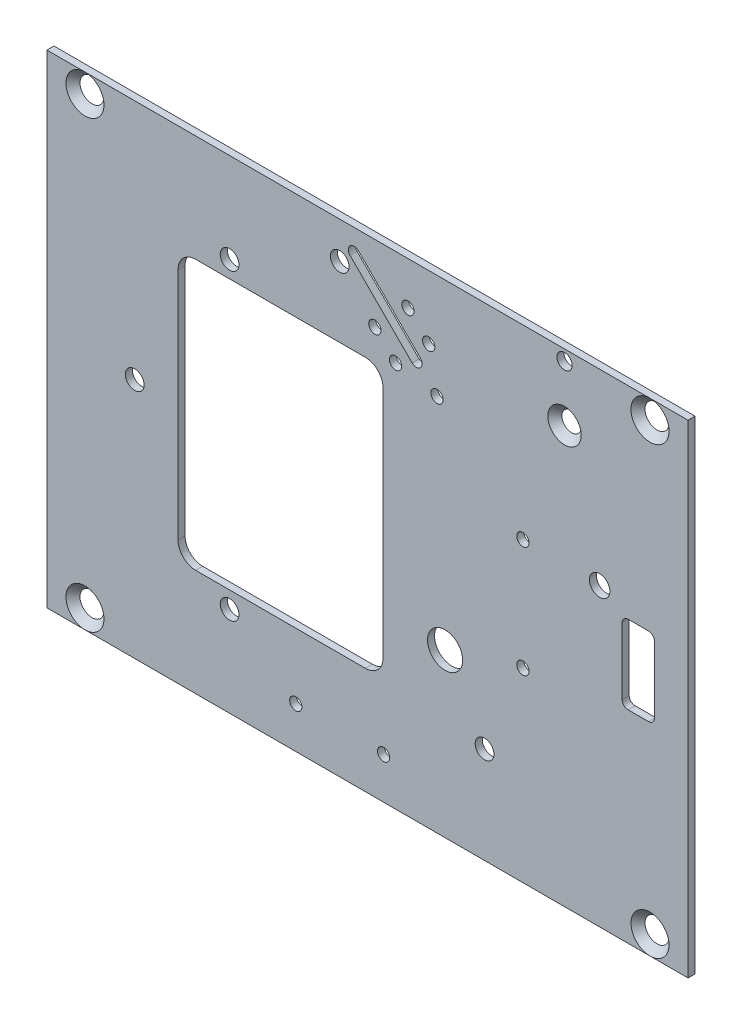
from build123d import *

# Parameters (mm, degrees)
SKETCH1_W                                    = 109.5
SKETCH1_H                                    = 82.5
SKETCH1_R                                    = 1.6
SKETCH1_R_2                                  = 1.05
SKETCH1_R_3                                  = 1.75
BOSS_EXTRUDE1_DEPTH                          = 1.2
CSK_FOR_M3_FLAT_COUNTERSUNK_HEAD_SCR_2_COUNT = 2
CSK_FOR_M3_FLAT_COUNTERSUNK_HEAD_SCR_2_PITCH = 76
CSK_FOR_M3_FLAT_COUNTERSUNK_HEAD_SCR_3_COUNT = 2
CSK_FOR_M3_FLAT_COUNTERSUNK_HEAD_SCR_3_PITCH = 122.834237898
CSK_FOR_M3_FLAT_COUNTERSUNK_HEAD_SCR_4_COUNT = 2
CSK_FOR_M3_FLAT_COUNTERSUNK_HEAD_SCR_4_PITCH = 96.5
F_2_6_2_6_DIAMETER_HOLE1_D                   = 2.6
CUT_EXTRUDE1_REACH                           = 101.438
SKETCH9_R                                    = 1.05
SKETCH9_R_2                                  = 3
SKETCH9_W                                    = 35
SKETCH9_H                                    = 46
SKETCH9_W_2                                  = 5.5
SKETCH9_H_2                                  = 13.4
FILLET1_R                                    = 3
FILLET2_R                                    = 1
SKETCH10_W                                   = 6
SKETCH10_H                                   = 6
BOSS_EXTRUDE2_DEPTH                          = 10


with BuildPart() as part:
    # Sketch1 → Boss-Extrude1 (new body)
    with BuildSketch(Plane.XY):
        with Locations((0, -41.75)):
            Rectangle(SKETCH1_W, SKETCH1_H)
        with Locations((-23.55, -67.625)):
            Circle(SKETCH1_R, mode=Mode.SUBTRACT)
        with Locations((-23.55, -15.875)):
            Circle(SKETCH1_R, mode=Mode.SUBTRACT)
        with Locations((-4.75, -6.75)):
            Circle(SKETCH1_R, mode=Mode.SUBTRACT)
        with Locations((-39.75, -41.75)):
            Circle(SKETCH1_R, mode=Mode.SUBTRACT)
        with Locations((19.998737342, -66.498737342)):
            Circle(SKETCH1_R, mode=Mode.SUBTRACT)
        with Locations((-12.25, -75.92862289)):
            Circle(SKETCH1_R_2, mode=Mode.SUBTRACT)
        with Locations((2.75, -75.92862289)):
            Circle(SKETCH1_R_2, mode=Mode.SUBTRACT)
        with Locations((26.542856399, -51.25)):
            Circle(SKETCH1_R_2, mode=Mode.SUBTRACT)
        with Locations((26.542856399, -32.25)):
            Circle(SKETCH1_R_2, mode=Mode.SUBTRACT)
        with Locations((39.65, -32.5)):
            Circle(SKETCH1_R_3, mode=Mode.SUBTRACT)
    extrude(amount=BOSS_EXTRUDE1_DEPTH)

    # Sketch3 → CSK for M3 Flat Countersunk Head Screw1 (revolve, cut)
    with BuildSketch(Plane(origin=(-48.25, -3.75, 1.2), x_dir=(0, -1, 0), z_dir=(1, 0, 0))):
        Polygon((0, 0), (0, 1.2), (1.6, 1.2), (1.6, 1.65), (3.25, 0), align=None)
    csk_for_m3_flat_countersunk_head_screw1 = revolve(axis=Axis((-48.25, -3.75, 7.55), (0, 0, -1)), mode=Mode.SUBTRACT)

    # CSK for M3 Flat Countersunk Head Scr 2: CSK for M3 Flat Countersunk Head Screw1 ×2
    with Locations(*[(0, -i * CSK_FOR_M3_FLAT_COUNTERSUNK_HEAD_SCR_2_PITCH, 0) for i in range(1, CSK_FOR_M3_FLAT_COUNTERSUNK_HEAD_SCR_2_COUNT)]):
        add(csk_for_m3_flat_countersunk_head_screw1, mode=Mode.SUBTRACT)

    # CSK for M3 Flat Countersunk Head Scr 3: CSK for M3 Flat Countersunk Head Screw1 ×2
    with Locations(*[Vector(0.7856115823348563, -0.6187200026678655, 0) * (i * CSK_FOR_M3_FLAT_COUNTERSUNK_HEAD_SCR_3_PITCH) for i in range(1, CSK_FOR_M3_FLAT_COUNTERSUNK_HEAD_SCR_3_COUNT)]):
        add(csk_for_m3_flat_countersunk_head_screw1, mode=Mode.SUBTRACT)

    # CSK for M3 Flat Countersunk Head Scr 4: CSK for M3 Flat Countersunk Head Screw1 ×2
    with Locations(*[(i * CSK_FOR_M3_FLAT_COUNTERSUNK_HEAD_SCR_4_PITCH, 0, 0) for i in range(1, CSK_FOR_M3_FLAT_COUNTERSUNK_HEAD_SCR_4_COUNT)]):
        add(csk_for_m3_flat_countersunk_head_screw1, mode=Mode.SUBTRACT)

    # Sketch5 → CSK for M2.5 Flat Countersunk Head Screw1 (revolve, cut)
    with BuildSketch(Plane(origin=(33.65, -11.85, 1.2), x_dir=(0, -1, 0), z_dir=(1, 0, 0))):
        Polygon((0, 0), (0, 1.2), (1.35, 1.2), (1.35, 1.5), (2.85, 0), align=None)
    revolve(axis=Axis((33.65, -11.85, 7.55), (0, 0, -1)), mode=Mode.SUBTRACT)

    # Ø2.6 (2.6) Diameter Hole1 (through all)
    with Locations(Plane.XY.offset(1.2)):
        with Locations((33.65, -2.32)):
            Hole(F_2_6_2_6_DIAMETER_HOLE1_D / 2)

    # Sketch9 → Cut-Extrude1 (cut, up to next)
    with BuildSketch(Plane.XY.offset(1.2), mode=Mode.PRIVATE) as cut_extrude1_sk1:
        with Locations((1.26040764, -13.467514421)):
            Circle(SKETCH9_R)
    cut_extrude1_tool1 = extrude(cut_extrude1_sk1.sketch, amount=-CUT_EXTRUDE1_REACH, mode=Mode.PRIVATE) & part.part
    # Sketch9 → Cut-Extrude1 (cut, up to next)
    with BuildSketch(Plane.XY.offset(1.2), mode=Mode.PRIVATE) as cut_extrude1_sk2:
        with Locations((6.91726189, -7.810660172)):
            Circle(SKETCH9_R)
    cut_extrude1_tool2 = extrude(cut_extrude1_sk2.sketch, amount=-CUT_EXTRUDE1_REACH, mode=Mode.PRIVATE) & part.part
    # Sketch9 → Cut-Extrude1 (cut, up to next)
    with BuildSketch(Plane.XY.offset(1.2), mode=Mode.PRIVATE) as cut_extrude1_sk3:
        with Locations((10.452795796, -11.346194078)):
            Circle(SKETCH9_R)
    cut_extrude1_tool3 = extrude(cut_extrude1_sk3.sketch, amount=-CUT_EXTRUDE1_REACH, mode=Mode.PRIVATE) & part.part
    # Sketch9 → Cut-Extrude1 (cut, up to next)
    with BuildSketch(Plane.XY.offset(1.2), mode=Mode.PRIVATE) as cut_extrude1_sk4:
        with Locations((13.25, -55.25)):
            Circle(SKETCH9_R_2)
    cut_extrude1_tool4 = extrude(cut_extrude1_sk4.sketch, amount=-CUT_EXTRUDE1_REACH, mode=Mode.PRIVATE) & part.part
    # Sketch9 → Cut-Extrude1 (cut, up to next)
    with BuildSketch(Plane.XY.offset(1.2), mode=Mode.PRIVATE) as cut_extrude1_sk5:
        with Locations((4.795941546, -17.003048327)):
            Circle(SKETCH9_R)
    cut_extrude1_tool5 = extrude(cut_extrude1_sk5.sketch, amount=-CUT_EXTRUDE1_REACH, mode=Mode.PRIVATE) & part.part
    # Sketch9 → Cut-Extrude1 (cut, up to next)
    with BuildSketch(Plane.XY.offset(1.2), mode=Mode.PRIVATE) as cut_extrude1_sk6:
        with Locations((11.867009358, -18.41726189)):
            Circle(SKETCH9_R)
    cut_extrude1_tool6 = extrude(cut_extrude1_sk6.sketch, amount=-CUT_EXTRUDE1_REACH, mode=Mode.PRIVATE) & part.part
    # Sketch9 → Cut-Extrude1 (cut, up to next)
    with BuildSketch(Plane.XY.offset(1.2), mode=Mode.PRIVATE) as cut_extrude1_sk7:
        with Locations((-14.85, -41.75)):
            Rectangle(SKETCH9_W, SKETCH9_H)
    cut_extrude1_tool7 = extrude(cut_extrude1_sk7.sketch, amount=-CUT_EXTRUDE1_REACH, mode=Mode.PRIVATE) & part.part
    # Sketch9 → Cut-Extrude1 (cut, up to next)
    with BuildSketch(Plane.XY.offset(1.2), mode=Mode.PRIVATE) as cut_extrude1_sk8:
        with BuildLine():
            Line((7.624368671, -15.588834765), (-2.982233047, -4.982233047))
            ThreePointArc((-2.982233047, -4.982233047), (-2.982233047, -3.568019485), (-1.568019485, -3.568019485))
            Line((-1.568019485, -3.568019485), (9.038582233, -14.174621202))
            ThreePointArc((9.038582233, -14.174621202), (9.038582233, -15.588834765), (7.624368671, -15.588834765))
        make_face()
    cut_extrude1_tool8 = extrude(cut_extrude1_sk8.sketch, amount=-CUT_EXTRUDE1_REACH, mode=Mode.PRIVATE) & part.part
    # Sketch9 → Cut-Extrude1 (cut, up to next)
    with BuildSketch(Plane.XY.offset(1.2), mode=Mode.PRIVATE) as cut_extrude1_sk9:
        with Locations((46.25, -41.75)):
            Rectangle(SKETCH9_W_2, SKETCH9_H_2)
    cut_extrude1_tool9 = extrude(cut_extrude1_sk9.sketch, amount=-CUT_EXTRUDE1_REACH, mode=Mode.PRIVATE) & part.part
    add(cut_extrude1_tool1.solids().sort_by_distance((1.260408, -13.467514, 1.2))[0], mode=Mode.SUBTRACT)
    add(cut_extrude1_tool2.solids().sort_by_distance((6.917262, -7.81066, 1.2))[0], mode=Mode.SUBTRACT)
    add(cut_extrude1_tool3.solids().sort_by_distance((10.452796, -11.346194, 1.2))[0], mode=Mode.SUBTRACT)
    add(cut_extrude1_tool4.solids().sort_by_distance((13.25, -55.25, 1.2))[0], mode=Mode.SUBTRACT)
    add(cut_extrude1_tool5.solids().sort_by_distance((4.795942, -17.003048, 1.2))[0], mode=Mode.SUBTRACT)
    add(cut_extrude1_tool6.solids().sort_by_distance((11.867009, -18.417262, 1.2))[0], mode=Mode.SUBTRACT)
    add(cut_extrude1_tool7.solids().sort_by_distance((-14.85, -41.75, 1.2))[0], mode=Mode.SUBTRACT)
    add(cut_extrude1_tool8.solids().sort_by_distance((3.028175, -9.578427, 1.2))[0], mode=Mode.SUBTRACT)
    add(cut_extrude1_tool9.solids().sort_by_distance((46.25, -41.75, 1.2))[0], mode=Mode.SUBTRACT)

    # Fillet1
    fillet1_edges = [part.edges().sort_by_distance(p)[0] for p in [
        (2.65, -18.75, 0.6),
        (2.65, -64.75, 0.6),
        (-32.35, -64.75, 0.6),
        (-32.35, -18.75, 0.6),
    ]]
    fillet(fillet1_edges, radius=FILLET1_R)

    # Fillet2
    fillet2_edges = [part.edges().sort_by_distance(p)[0] for p in [
        (43.5, -48.45, 0.6),
        (43.5, -35.05, 0.6),
        (49, -35.05, 0.6),
        (49, -48.45, 0.6),
    ]]
    fillet(fillet2_edges, radius=FILLET2_R)

    # Sketch10 → Boss-Extrude2 (add)
    with BuildSketch(Plane(origin=(0, 0, 0), x_dir=(-1, 0, 0), z_dir=(0, 0, -1))):
        with Locations((-11.5, -67)):
            Rectangle(SKETCH10_W, SKETCH10_H)
    extrude(amount=BOSS_EXTRUDE2_DEPTH)


solid = part.part
